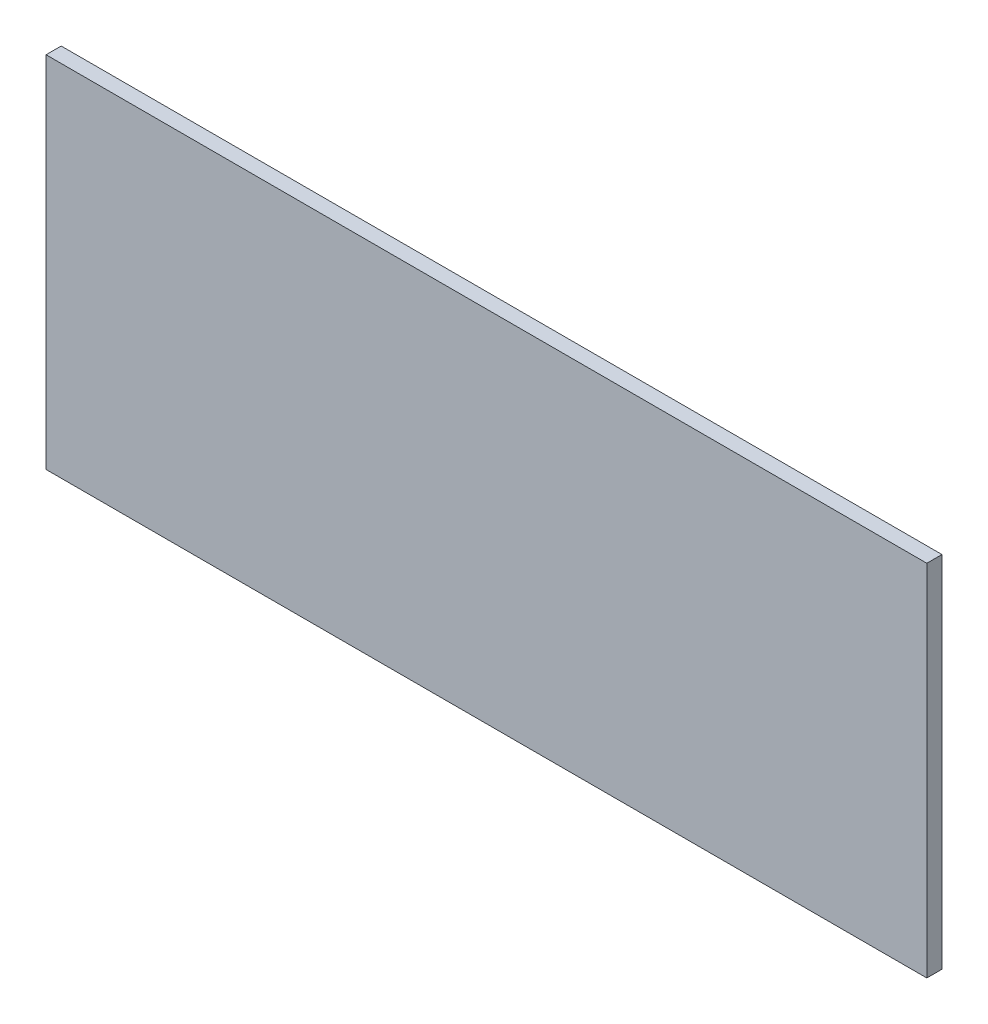
from build123d import *

# Parameters (mm, degrees)
CROQUIS1_W              = 320
CROQUIS1_H              = 130.5
SALIENTE_EXTRUIR1_DEPTH = 5.5


with BuildPart() as part:
    # Croquis1 → Saliente-Extruir1 (new body)
    with BuildSketch(Plane.XY):
        with Locations((78.088629402, -25.790692395)):
            Rectangle(CROQUIS1_W, CROQUIS1_H)
    extrude(amount=SALIENTE_EXTRUIR1_DEPTH)


solid = part.part
